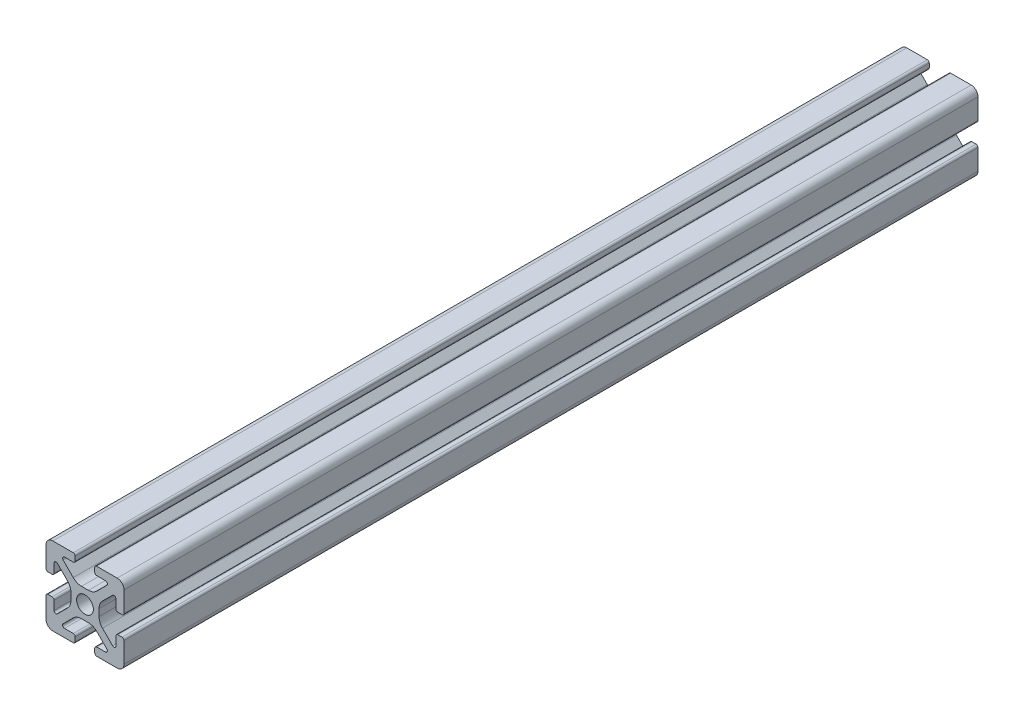
from build123d import *

# Parameters (mm, degrees)
BOSS_EXTRUDE1_DEPTH = 109.5


with BuildPart() as part:
    # Sketch4 → Boss-Extrude1 (new, symmetric)
    with BuildSketch(Plane.XY):
        with BuildLine():
            Line((3, -10), (8.25, -10))
            ThreePointArc((8.25, -10), (9.487436867, -9.487436867), (10, -8.25))
            Line((10, -8.25), (10, -3))
            ThreePointArc((10, -3), (9.853553391, -2.646446609), (9.5, -2.5))
            Line((9.5, -2.5), (8.424621202, -2.5))
            ThreePointArc((8.424621202, -2.5), (8.071067812, -2.646446609), (7.924621202, -3))
            Line((7.924621202, -3), (7.924621202, -5.25))
            ThreePointArc((7.924621202, -5.25), (7.615962919, -5.711939766), (7.071067812, -5.603553391))
            Line((7.071067812, -5.603553391), (4.478679656, -3.011165235))
            ThreePointArc((4.478679656, -3.011165235), (3.828361402, -2.037895189), (3.6, -0.889844892))
            Line((3.6, -0.889844892), (3.6, 0))
            Line((3.6, 0), (2.15, 0))
            ThreePointArc((2.15, 0), (1.52027958, -1.52027958), (0, -2.15))
            Line((0, -2.15), (0, -3.6))
            Line((0, -3.6), (0.889844892, -3.6))
            ThreePointArc((0.889844892, -3.6), (2.037895189, -3.828361402), (3.011165235, -4.478679656))
            Line((3.011165235, -4.478679656), (5.603553391, -7.071067812))
            ThreePointArc((5.603553391, -7.071067812), (5.711939766, -7.615962919), (5.25, -7.924621202))
            Line((5.25, -7.924621202), (3, -7.924621202))
            ThreePointArc((3, -7.924621202), (2.646446609, -8.071067812), (2.5, -8.424621202))
            Line((2.5, -8.424621202), (2.5, -9.5))
            ThreePointArc((2.5, -9.5), (2.646446609, -9.853553391), (3, -10))
        make_face()
    extrude(amount=BOSS_EXTRUDE1_DEPTH, both=True)

    # Mirror1: part across plane


with BuildPart() as part_1:
    add(part.part)
    add(part.part.mirror(Plane(origin=(0, 0, 0), x_dir=(0, 0, 1), z_dir=(1, 0, 0))))

    # Mirror2: part across plane


with BuildPart() as part_2:
    add(part_1.part)
    add(part_1.part.mirror(Plane.ZX))


solid = part_2.part
